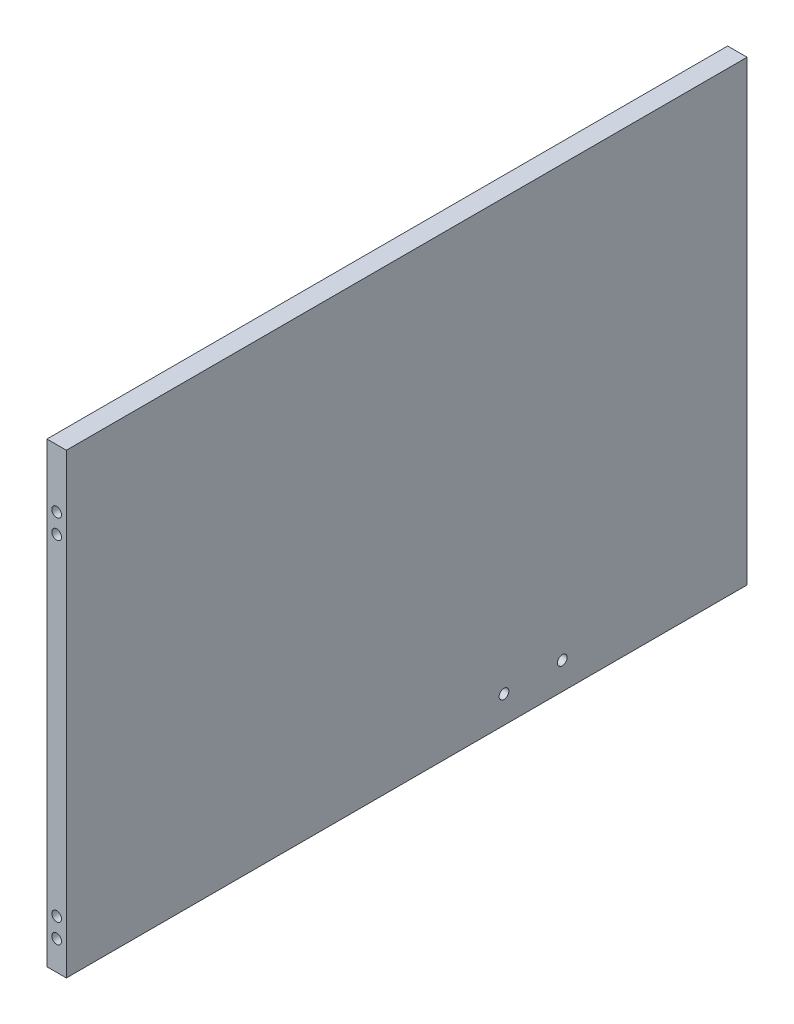
from build123d import *

# Parameters (mm, degrees)
SKETCH1_W           = 350
SKETCH1_H           = 235
BOSS_EXTRUDE1_DEPTH = 10
SKETCH2_R           = 2.5
CUT_EXTRUDE1_DEPTH  = 212.024287702
SKETCH3_R           = 2.5
CUT_EXTRUDE2_DEPTH  = 10


with BuildPart() as part:
    # Sketch1 → Boss-Extrude1 (new body)
    with BuildSketch(Plane(origin=(0, 0, 0), x_dir=(0, 0, -1), z_dir=(1, 0, 0))):
        Rectangle(SKETCH1_W, SKETCH1_H)
    extrude(amount=BOSS_EXTRUDE1_DEPTH)

    # Sketch2 → Cut-Extrude1 (cut, through all)
    with BuildSketch(Plane(origin=(10, 0, 0), x_dir=(0, 0, -1), z_dir=(1, 0, 0))):
        with Locations((50, -103.5)):
            Circle(SKETCH2_R)
        with Locations((80, -103.5)):
            Circle(SKETCH2_R)
    extrude(amount=-CUT_EXTRUDE1_DEPTH, mode=Mode.SUBTRACT)

    # Sketch3 → Cut-Extrude2 (cut)
    with BuildSketch(Plane(origin=(0, 0, -175), x_dir=(-1, 0, 0), z_dir=(0, 0, -1))):
        with Locations(Location((-5, 87.5, 0), (0, 0, 90))):
            Circle(SKETCH3_R)
        with Locations(Location((-5, 77.5, 0), (0, 0, 90))):
            Circle(SKETCH3_R)
        with Locations(Location((-5, -92.5, 0), (0, 0, 90))):
            Circle(SKETCH3_R)
        with Locations(Location((-5, -102.5, 0), (0, 0, 90))):
            Circle(SKETCH3_R)
    cut_extrude2 = extrude(amount=-CUT_EXTRUDE2_DEPTH, mode=Mode.SUBTRACT)

    # Mirror1: Cut-Extrude2 across plane
    add(cut_extrude2.mirror(Plane.XY), mode=Mode.SUBTRACT)


solid = part.part
